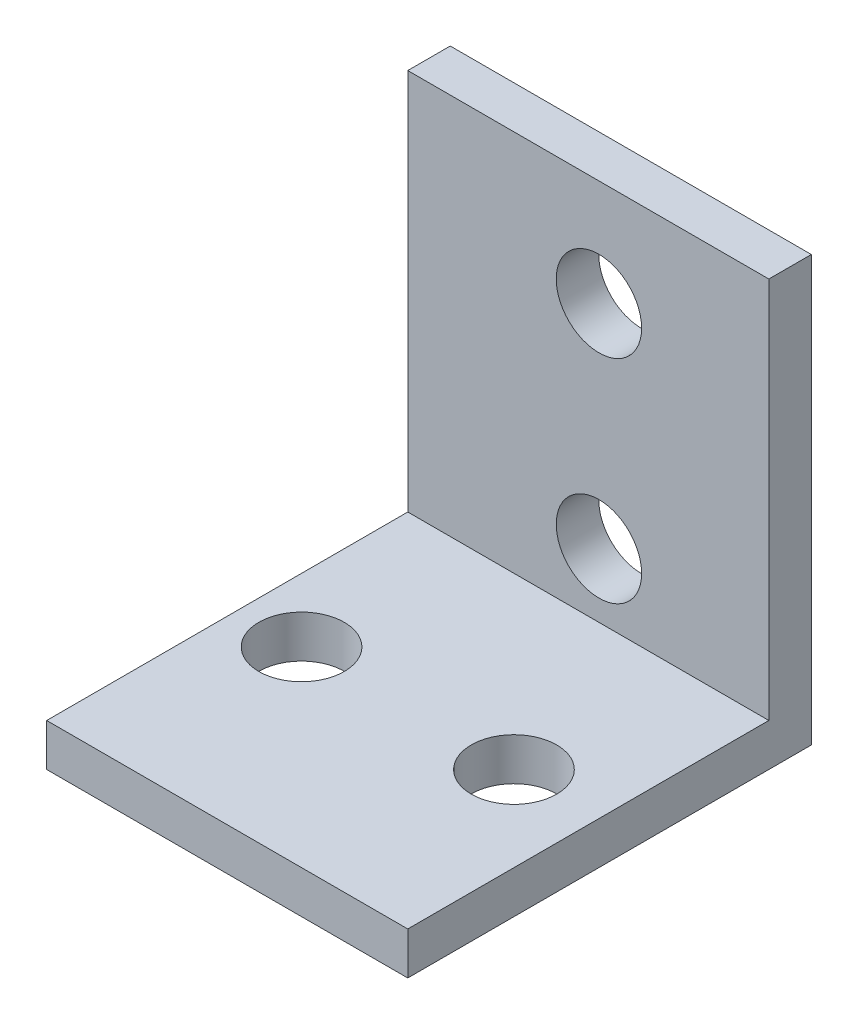
from build123d import *

# Parameters (mm, degrees)
SKETCH1_W           = 21.59
SKETCH1_H           = 25.4
BOSS_EXTRUDE1_DEPTH = 24.13
SKETCH2_W           = 21.59
SKETCH2_H           = 22.86
CUT_EXTRUDE1_DEPTH  = 42.152703435
SKETCH3_R           = 2.5527
CUT_EXTRUDE2_DEPTH  = 40.716699259
SKETCH4_R           = 2.5527
CUT_EXTRUDE3_DEPTH  = 40.635395797


with BuildPart() as part:
    # Sketch1 → Boss-Extrude1 (new body)
    with BuildSketch(Plane.XY):
        with Locations((10.795, 12.7)):
            Rectangle(SKETCH1_W, SKETCH1_H)
    extrude(amount=BOSS_EXTRUDE1_DEPTH)

    # Sketch2 → Cut-Extrude1 (cut, through all)
    with BuildSketch(Plane(origin=(21.59, 0, 0), x_dir=(0, 0, -1), z_dir=(1, 0, 0))):
        with Locations((-13.335, 13.97)):
            Rectangle(SKETCH2_W, SKETCH2_H)
    extrude(amount=-CUT_EXTRUDE1_DEPTH, mode=Mode.SUBTRACT)

    # Sketch3 → Cut-Extrude2 (cut, through all)
    with BuildSketch(Plane.XY.offset(2.54)):
        with Locations((11.43, 19.05)):
            Circle(SKETCH3_R)
        with Locations((11.43, 6.35)):
            Circle(SKETCH3_R)
    extrude(amount=-CUT_EXTRUDE2_DEPTH, mode=Mode.SUBTRACT)

    # Sketch4 → Cut-Extrude3 (cut, through all)
    with BuildSketch(Plane(origin=(0, 2.54, 0), x_dir=(1, 0, 0), z_dir=(0, 1, 0))):
        with Locations(Location((16.51, -12.7, 0), (0, 0, 270))):
            Circle(SKETCH4_R)
        with Locations(Location((3.81, -12.7, 0), (0, 0, 270))):
            Circle(SKETCH4_R)
    extrude(amount=-CUT_EXTRUDE3_DEPTH, mode=Mode.SUBTRACT)


solid = part.part
